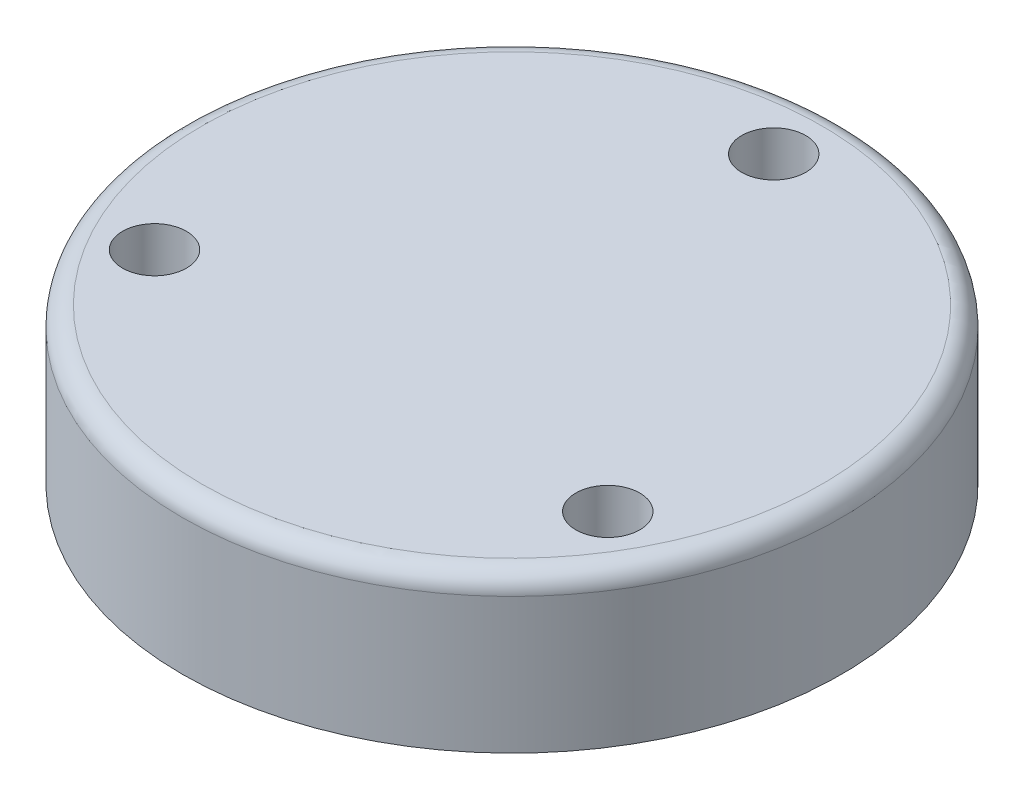
from build123d import *

# Parameters (mm, degrees)
SKETCH_1_R          = 17
EXTRUDE_1_DEPTH     = 8
SKETCH_2_R          = 1.65
CUT_EXTRUDE_1_DEPTH = 20
FILLET_1_R          = 1


with BuildPart() as part:
    # Эскиз1 → Бобышка-Вытянуть1 (new body)
    with BuildSketch(Plane(origin=(0, 0, 0), x_dir=(1, 0, 0), z_dir=(0, 1, 0))):
        with Locations(Location((0, 0, 0), (0, 0, 270))):
            Circle(SKETCH_1_R)
    extrude(amount=EXTRUDE_1_DEPTH)

    # Эскиз2 → Вырез-Вытянуть1 (cut)
    with BuildSketch(Plane(origin=(0, 8, 0), x_dir=(1, 0, 0), z_dir=(0, 1, 0))):
        with Locations(Location((0, 13.5, 0), (0, 0, 270))):
            Circle(SKETCH_2_R)
        with Locations(Location((11.691342951, -6.75, 0), (0, 0, 270))):
            Circle(SKETCH_2_R)
        with Locations(Location((-11.691342951, -6.75, 0), (0, 0, 270))):
            Circle(SKETCH_2_R)
    extrude(amount=-CUT_EXTRUDE_1_DEPTH, mode=Mode.SUBTRACT)

    # Скругление1
    fillet_1_edges = [part.edges().sort_by_distance(p)[0] for p in [
        (0, 8, -17),
    ]]
    fillet(fillet_1_edges, radius=FILLET_1_R)


solid = part.part
